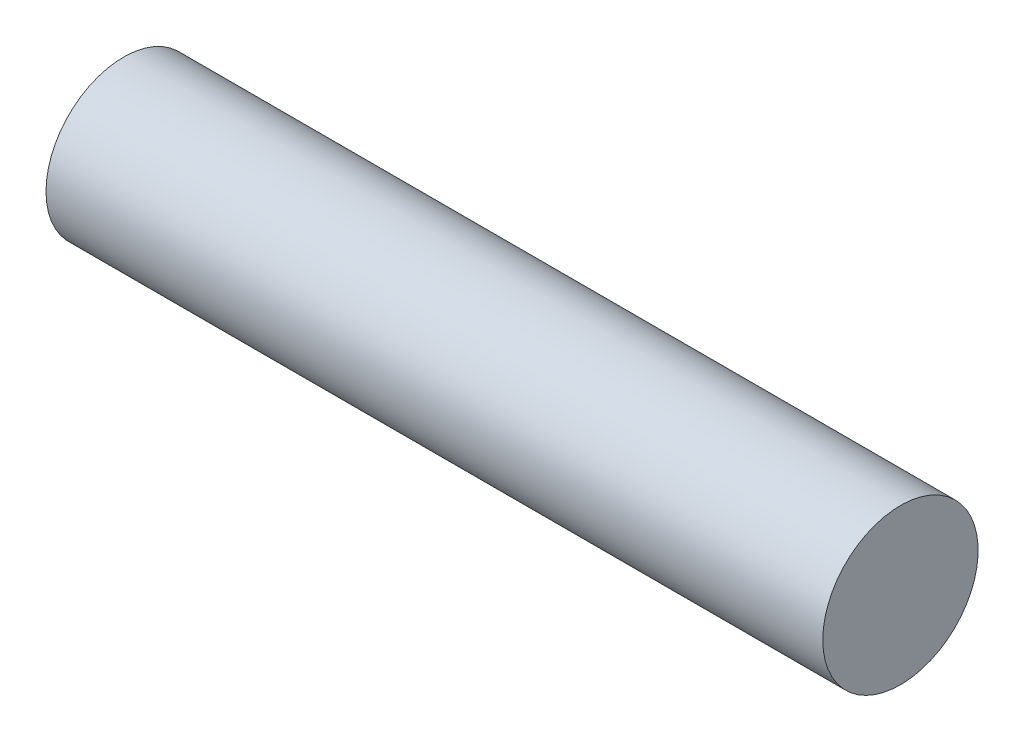
from build123d import *

# Parameters (mm, degrees)
SKETCH1_W = 10
SKETCH1_H = 1


with BuildPart() as part:
    # Sketch1 → Revolve1 (revolve)
    with BuildSketch(Plane.XY, mode=Mode.PRIVATE) as revolve1_sk:
        Rectangle(SKETCH1_W, SKETCH1_H)
    revolve(revolve1_sk.sketch.rotate(Axis((-5, -0.5, 0), (1, 0, 0)), 90), axis=Axis((-5, -0.5, 0), (1, 0, 0)))


solid = part.part
